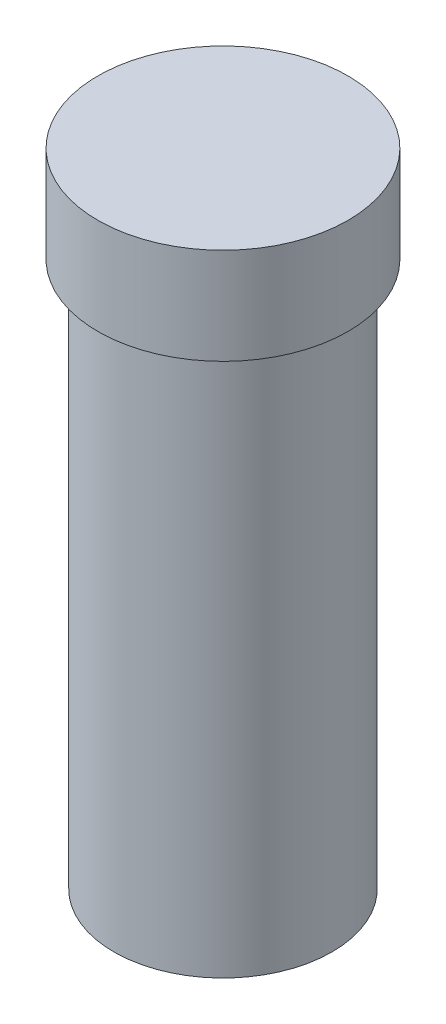
from build123d import *

# Parameters (mm, degrees)
SKETCH_4_W          = 25
SKETCH_4_H          = 16
CUT_EXTRUDE_1_DEPTH = 65


with BuildPart() as part:
    # Эскиз3 → Повернуть2 (revolve)
    with BuildSketch(Plane.XY):
        Polygon((0, 0), (17, 0), (17, 85), (19.5, 85), (19.5, 100), (0, 100), align=None)
    revolve(axis=Axis((0, 0, 0), (0, 1, 0)))

    # Эскиз4 → Вырез-Вытянуть1 (cut)
    with BuildSketch(Plane.XZ):
        Rectangle(SKETCH_4_W, SKETCH_4_H)
    extrude(amount=-CUT_EXTRUDE_1_DEPTH, mode=Mode.SUBTRACT)


solid = part.part
